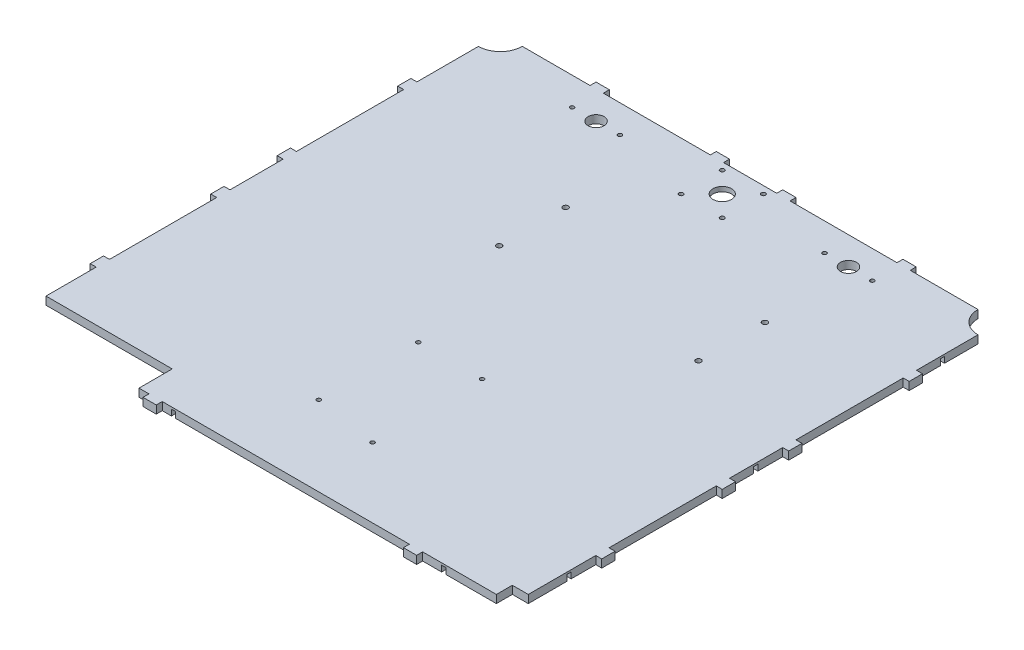
from build123d import *

# Parameters (mm, degrees)
SALIENTE_EXTRUIR1_DEPTH = 6
CORTAR_EXTRUIR1_DEPTH   = 4.5
CROQUIS5_R              = 7
CROQUIS5_R_2            = 1.6
CROQUIS5_R_3            = 6
CROQUIS5_R_4            = 1.5
CROQUIS5_W              = 12
CROQUIS5_H              = 12
CORTAR_EXTRUIR2_DEPTH   = 6
CROQUIS7_R              = 2
CROQUIS7_R_2            = 1.5
CROQUIS7_W              = 95
CROQUIS7_H              = 25
CORTAR_EXTRUIR4_DEPTH   = 10
CORTAR_EXTRUIR5_START   = -2.5
CROQUIS8_R              = 11
CROQUIS8_R_2            = 7
CROQUIS8_R_3            = 4.5
CROQUIS8_R_4            = 1.5
CORTAR_EXTRUIR5_DEPTH   = 2.5


with BuildPart() as part:
    # Croquis1 → Saliente-Extruir1 (new body)
    with BuildSketch(Plane(origin=(0, 0, 0), x_dir=(1, 0, 0), z_dir=(0, 1, 0))):
        with BuildLine():
            Line((0, 0), (67.5, 0))
            Line((67.5, 0), (77.5, 0))
            Line((77.5, 0), (102.5, 0))
            Line((102.5, 0), (102.5, -4.5))
            Line((102.5, -4.5), (112.5, -4.5))
            Line((112.5, -4.5), (112.5, 0))
            Line((112.5, 0), (298.5, 0))
            Line((298.5, 0), (298.5, -4.5))
            Line((298.5, -4.5), (308.5, -4.5))
            Line((308.5, -4.5), (308.5, 0))
            Line((308.5, 0), (376, 0))
            Line((376, 0), (376, 62.8))
            Line((376, 62.8), (380.5, 62.8))
            Line((380.5, 62.8), (380.5, 72.8))
            Line((380.5, 72.8), (376, 72.8))
            Line((376, 72.8), (376, 153.5))
            Line((376, 153.5), (380.5, 153.5))
            Line((380.5, 153.5), (380.5, 163.5))
            Line((380.5, 163.5), (376, 163.5))
            Line((376, 163.5), (376, 203.5))
            Line((376, 203.5), (380.5, 203.5))
            Line((380.5, 203.5), (380.5, 213.5))
            Line((380.5, 213.5), (376, 213.5))
            Line((376, 213.5), (376, 294.2))
            Line((376, 294.2), (380.5, 294.2))
            Line((380.5, 294.2), (380.5, 304.2))
            Line((380.5, 304.2), (376, 304.2))
            Line((376, 304.2), (376, 350.5))
            ThreePointArc((376, 350.5), (364.33273811, 355.33273811), (359.5, 367))
            Line((359.5, 367), (308.5, 367))
            Line((308.5, 367), (308.5, 371.5))
            Line((308.5, 371.5), (298.5, 371.5))
            Line((298.5, 371.5), (298.5, 367))
            Line((298.5, 367), (218, 367))
            Line((218, 367), (218, 371.5))
            Line((218, 371.5), (208, 371.5))
            Line((208, 371.5), (208, 367))
            Line((208, 367), (168, 367))
            Line((168, 367), (168, 371.5))
            Line((168, 371.5), (158, 371.5))
            Line((158, 371.5), (158, 367))
            Line((158, 367), (77.5, 367))
            Line((77.5, 367), (77.5, 371.5))
            Line((77.5, 371.5), (67.5, 371.5))
            Line((67.5, 371.5), (67.5, 367))
            Line((67.5, 367), (16.5, 367))
            ThreePointArc((16.5, 367), (11.66726189, 355.33273811), (0, 350.5))
            Line((0, 350.5), (0, 304.2))
            Line((0, 304.2), (-4.5, 304.2))
            Line((-4.5, 304.2), (-4.5, 294.2))
            Line((-4.5, 294.2), (0, 294.2))
            Line((0, 294.2), (0, 213.5))
            Line((0, 213.5), (-4.5, 213.5))
            Line((-4.5, 213.5), (-4.5, 203.5))
            Line((-4.5, 203.5), (0, 203.5))
            Line((0, 203.5), (0, 163.5))
            Line((0, 163.5), (-4.5, 163.5))
            Line((-4.5, 163.5), (-4.5, 153.5))
            Line((-4.5, 153.5), (0, 153.5))
            Line((0, 153.5), (0, 72.8))
            Line((0, 72.8), (-4.5, 72.8))
            Line((-4.5, 72.8), (-4.5, 62.8))
            Line((-4.5, 62.8), (0, 62.8))
            Line((0, 62.8), (0, 0))
        make_face()
    extrude(amount=-SALIENTE_EXTRUIR1_DEPTH)

    # Croquis3 → Cortar-Extruir1 (cut)
    with BuildSketch(Plane.XZ.offset(6)):
        with BuildLine():
            Line((325.901879925, -6.500225242), (325.901879925, 0))
            Line((325.901879925, 0), (322.801879925, 0))
            Line((322.801879925, 0), (322.801879925, -6.500225243))
            ThreePointArc((322.801879925, -6.500225243), (321.87727529, -7.028314779), (321.511542294, -8.028320611))
            Line((321.511542294, -8.028320611), (321.511542294, -9.578320611))
            ThreePointArc((321.511542294, -9.578320611), (321.700239124, -10.319504582), (322.220385751, -10.880225243))
            Line((322.220385751, -10.880225243), (322.389630684, -10.880225243))
            ThreePointArc((322.389630684, -10.880225243), (324.351879925, -11.693235227), (326.314129166, -10.880225242))
            Line((326.314129166, -10.880225242), (326.483374099, -10.880225243))
            ThreePointArc((326.483374099, -10.880225243), (327.003520726, -10.319504582), (327.192217556, -9.578320611))
            Line((327.192217556, -9.578320611), (327.192217556, -8.028320611))
            ThreePointArc((327.192217556, -8.028320611), (326.82648456, -7.028314779), (325.901879925, -6.500225242))
        make_face()
        with BuildLine():
            Line((322.801879925, -360.499774758), (322.801879925, -367))
            Line((322.801879925, -367), (325.901879925, -367))
            Line((325.901879925, -367), (325.901879925, -360.499774758))
            ThreePointArc((325.901879925, -360.499774758), (326.82648456, -359.971685221), (327.192217556, -358.971679389))
            Line((327.192217556, -358.971679389), (327.192217556, -357.421679389))
            ThreePointArc((327.192217556, -357.421679389), (327.003520726, -356.680495418), (326.483374099, -356.119774758))
            Line((326.483374099, -356.119774758), (326.314129166, -356.119774758))
            ThreePointArc((326.314129166, -356.119774758), (324.351879925, -355.306764773), (322.389630684, -356.119774757))
            Line((322.389630684, -356.119774757), (322.220385751, -356.119774757))
            ThreePointArc((322.220385751, -356.119774757), (321.700239124, -356.680495418), (321.511542294, -357.421679389))
            Line((321.511542294, -357.421679389), (321.511542294, -358.971679389))
            ThreePointArc((321.511542294, -358.971679389), (321.87727529, -359.971685221), (322.801879925, -360.499774758))
        make_face()
        with BuildLine():
            Line((6.500225243, -322.280922321), (0, -322.280922321))
            Line((0, -322.280922321), (0, -325.537612435))
            Line((0, -325.537612435), (6.500225243, -325.537612435))
            ThreePointArc((6.500225243, -325.537612435), (7.028314779, -326.46221707), (8.028320611, -326.827950066))
            Line((8.028320611, -326.827950066), (9.578320611, -326.827950066))
            ThreePointArc((9.578320611, -326.827950066), (10.319504582, -326.639253236), (10.880225243, -326.119106609))
            Line((10.880225243, -326.119106609), (10.880225243, -326.106551791))
            ThreePointArc((10.880225243, -326.106551791), (11.806178748, -323.987612435), (10.880225243, -321.86867308))
            Line((10.880225243, -321.86867308), (10.880225243, -321.699428147))
            ThreePointArc((10.880225243, -321.699428147), (10.606581913, -321.380766302), (10.257428876, -321.147274975))
            Line((10.257428876, -321.147274975), (8.707428876, -321.147274975))
            ThreePointArc((8.707428876, -321.147274975), (7.320165365, -321.161811269), (6.500225243, -322.280922321))
        make_face()
        with BuildLine():
            Line((6.500225242, -41.36), (0, -41.36))
            Line((0, -41.36), (0, -44.46))
            Line((0, -44.46), (6.500225243, -44.46))
            ThreePointArc((6.500225243, -44.46), (7.028314779, -45.384604635), (8.028320611, -45.750337631))
            Line((8.028320611, -45.750337631), (9.578320611, -45.750337631))
            ThreePointArc((9.578320611, -45.750337631), (10.319504582, -45.561640801), (10.880225243, -45.041494174))
            Line((10.880225243, -45.041494174), (10.880225243, -44.872249241))
            ThreePointArc((10.880225243, -44.872249241), (11.693235227, -42.91), (10.880225243, -40.947750759))
            Line((10.880225243, -40.947750759), (10.880225243, -40.778505826))
            ThreePointArc((10.880225243, -40.778505826), (10.319504582, -40.258359199), (9.578320611, -40.069662369))
            Line((9.578320611, -40.069662369), (8.028320611, -40.069662369))
            ThreePointArc((8.028320611, -40.069662369), (7.028314779, -40.435395365), (6.500225242, -41.36))
        make_face()
        with BuildLine():
            Line((8.028320611, -186.245954203), (9.578320611, -186.245954203))
            ThreePointArc((9.578320611, -186.245954203), (10.319504582, -186.057257373), (10.880225243, -185.537110746))
            Line((10.880225243, -185.537110746), (10.880225243, -185.367865814))
            ThreePointArc((10.880225243, -185.367865814), (11.693235227, -183.405616572), (10.880225243, -181.443367331))
            Line((10.880225243, -181.443367331), (10.880225243, -181.274122399))
            ThreePointArc((10.880225243, -181.274122399), (10.319504582, -180.753975771), (9.578320611, -180.565278941))
            Line((9.578320611, -180.565278941), (8.028320611, -180.565278941))
            ThreePointArc((8.028320611, -180.565278941), (7.028314779, -180.931011938), (6.500225243, -181.855616572))
            Line((6.500225243, -181.855616572), (0, -181.855616572))
            Line((0, -181.855616572), (0, -184.955616572))
            Line((0, -184.955616572), (6.500225243, -184.955616572))
            ThreePointArc((6.500225243, -184.955616572), (7.028314779, -185.880221207), (8.028320611, -186.245954203))
        make_face()
        with BuildLine():
            Line((122.550656557, -6.500225243), (122.550656557, 0))
            Line((122.550656557, 0), (119.450656557, 0))
            Line((119.450656557, 0), (119.450656557, -6.500225243))
            ThreePointArc((119.450656557, -6.500225243), (118.526051922, -7.028314779), (118.160318926, -8.028320611))
            Line((118.160318926, -8.028320611), (118.160318926, -9.578320611))
            ThreePointArc((118.160318926, -9.578320611), (118.349015756, -10.319504582), (118.869162383, -10.880225243))
            Line((118.869162383, -10.880225243), (119.038407316, -10.880225243))
            ThreePointArc((119.038407316, -10.880225243), (121.000656557, -11.693235227), (122.962905798, -10.880225243))
            Line((122.962905798, -10.880225243), (123.132150731, -10.880225243))
            ThreePointArc((123.132150731, -10.880225243), (123.652297358, -10.319504582), (123.840994188, -9.578320611))
            Line((123.840994188, -9.578320611), (123.840994188, -8.028320611))
            ThreePointArc((123.840994188, -8.028320611), (123.475261191, -7.028314779), (122.550656557, -6.500225243))
        make_face()
        with BuildLine():
            Line((369.499774757, -44.286426511), (376, -44.286426511))
            Line((376, -44.286426511), (376, -41.186426511))
            Line((376, -41.186426511), (369.499774757, -41.186426511))
            ThreePointArc((369.499774757, -41.186426511), (368.971685221, -40.261821877), (367.971679389, -39.89608888))
            Line((367.971679389, -39.89608888), (366.421679389, -39.89608888))
            ThreePointArc((366.421679389, -39.89608888), (365.680495418, -40.08478571), (365.119774757, -40.604932337))
            Line((365.119774757, -40.604932337), (365.119774757, -40.77417727))
            ThreePointArc((365.119774757, -40.77417727), (364.306764773, -42.736426511), (365.119774757, -44.698675752))
            Line((365.119774757, -44.698675752), (365.119774757, -44.867920685))
            ThreePointArc((365.119774757, -44.867920685), (365.680495418, -45.388067312), (366.421679389, -45.576764142))
            Line((366.421679389, -45.576764142), (367.971679389, -45.576764142))
            ThreePointArc((367.971679389, -45.576764142), (368.971685221, -45.211031146), (369.499774757, -44.286426511))
        make_face()
        with BuildLine():
            Line((367.971679389, -180.400754709), (366.421679389, -180.400754709))
            ThreePointArc((366.421679389, -180.400754709), (365.680495418, -180.589451539), (365.119774757, -181.109598166))
            Line((365.119774757, -181.109598166), (365.119774757, -181.278843099))
            ThreePointArc((365.119774757, -181.278843099), (364.306764773, -183.24109234), (365.119774757, -185.203341581))
            Line((365.119774757, -185.203341581), (365.119774757, -185.372586514))
            ThreePointArc((365.119774757, -185.372586514), (365.680495418, -185.892733141), (366.421679389, -186.081429971))
            Line((366.421679389, -186.081429971), (367.971679389, -186.081429971))
            ThreePointArc((367.971679389, -186.081429971), (368.971685221, -185.715696975), (369.499774757, -184.79109234))
            Line((369.499774757, -184.79109234), (376, -184.79109234))
            Line((376, -184.79109234), (376, -181.69109234))
            Line((376, -181.69109234), (369.499774757, -181.69109234))
            ThreePointArc((369.499774757, -181.69109234), (368.971685221, -180.766487705), (367.971679389, -180.400754709))
        make_face()
        with BuildLine():
            Line((369.499774757, -325.277950066), (376, -325.277950066))
            Line((376, -325.277950066), (376, -322.177950066))
            Line((376, -322.177950066), (369.499774757, -322.177950066))
            ThreePointArc((369.499774757, -322.177950066), (368.971685221, -321.253345432), (367.971679389, -320.887612435))
            Line((367.971679389, -320.887612435), (366.421679389, -320.887612435))
            ThreePointArc((366.421679389, -320.887612435), (365.680495418, -321.076309265), (365.119774757, -321.596455893))
            Line((365.119774757, -321.596455893), (365.119774757, -321.765700825))
            ThreePointArc((365.119774757, -321.765700825), (364.306764773, -323.727950066), (365.119774757, -325.690199308))
            Line((365.119774757, -325.690199308), (365.119774757, -325.85944424))
            ThreePointArc((365.119774757, -325.85944424), (365.680495418, -326.379590867), (366.421679389, -326.568287697))
            Line((366.421679389, -326.568287697), (367.971679389, -326.568287697))
            ThreePointArc((367.971679389, -326.568287697), (368.971685221, -326.202554701), (369.499774757, -325.277950066))
        make_face()
        with BuildLine():
            Line((50.098120075, -360.499774758), (50.098120075, -367))
            Line((50.098120075, -367), (53.198120075, -367))
            Line((53.198120075, -367), (53.198120075, -360.499774758))
            ThreePointArc((53.198120075, -360.499774758), (54.12272471, -359.971685221), (54.488457706, -358.971679389))
            Line((54.488457706, -358.971679389), (54.488457706, -357.421679389))
            ThreePointArc((54.488457706, -357.421679389), (54.299760876, -356.680495418), (53.779614249, -356.119774758))
            Line((53.779614249, -356.119774758), (53.610369316, -356.119774758))
            ThreePointArc((53.610369316, -356.119774758), (51.648120075, -355.306764773), (49.685870834, -356.119774757))
            Line((49.685870834, -356.119774757), (49.516625901, -356.119774757))
            ThreePointArc((49.516625901, -356.119774757), (48.996479274, -356.680495418), (48.807782444, -357.421679389))
            Line((48.807782444, -357.421679389), (48.807782444, -358.971679389))
            ThreePointArc((48.807782444, -358.971679389), (49.17351544, -359.971685221), (50.098120075, -360.499774758))
        make_face()
    extrude(amount=-CORTAR_EXTRUIR1_DEPTH, mode=Mode.SUBTRACT)

    # Croquis5 → Cortar-Extruir2 (cut)
    with BuildSketch(Plane(origin=(0, 0, 0), x_dir=(1, 0, 0), z_dir=(0, 1, 0))):
        with Locations(Location((188, 346, 0), (0, 0, 270))):
            Circle(CROQUIS5_R)
        with Locations(Location((172.5, 361.5, 0), (0, 0, 270))):
            Circle(CROQUIS5_R_2)
        with Locations(Location((203.5, 361.5, 0), (0, 0, 270))):
            Circle(CROQUIS5_R_2)
        with Locations(Location((203.5, 330.5, 0), (0, 0, 270))):
            Circle(CROQUIS5_R_2)
        with Locations(Location((172.5, 330.5, 0), (0, 0, 270))):
            Circle(CROQUIS5_R_2)
        with Locations(Location((93, 346, 0), (0, 0, 270))):
            Circle(CROQUIS5_R_3)
        with Locations(Location((111, 346, 0), (0, 0, 270))):
            Circle(CROQUIS5_R_4)
        with Locations(Location((75, 346, 0), (0, 0, 270))):
            Circle(CROQUIS5_R_4)
        with Locations(Location((301, 346, 0), (0, 0, 270))):
            Circle(CROQUIS5_R_4)
        with Locations(Location((265, 346, 0), (0, 0, 270))):
            Circle(CROQUIS5_R_4)
        with Locations(Location((283, 346, 0), (0, 0, 270))):
            Circle(CROQUIS5_R_3)
        with Locations((6, 6)):
            Rectangle(CROQUIS5_W, CROQUIS5_H)
        with Locations((370, 6)):
            Rectangle(CROQUIS5_W, CROQUIS5_H)
    extrude(amount=-CORTAR_EXTRUIR2_DEPTH, mode=Mode.SUBTRACT)

    # Croquis7 → Cortar-Extruir4 (cut)
    with BuildSketch(Plane(origin=(0, 0, 0), x_dir=(1, 0, 0), z_dir=(0, 1, 0))):
        with Locations(Location((137.744149305, 278.350339736, 0), (0, 0, 270))):
            Circle(CROQUIS7_R)
        with Locations(Location((137.744149305, 228.350339736, 0), (0, 0, 270))):
            Circle(CROQUIS7_R)
        with Locations(Location((287.744149305, 228.350339736, 0), (0, 0, 270))):
            Circle(CROQUIS7_R)
        with Locations(Location((287.744149305, 278.350339736, 0), (0, 0, 270))):
            Circle(CROQUIS7_R)
        with Locations(Location((218.27359351, 134.989356687, 0), (0, 0, 270))):
            Circle(CROQUIS7_R_2)
        with Locations(Location((170.27359351, 134.989356687, 0), (0, 0, 270))):
            Circle(CROQUIS7_R_2)
        with Locations(Location((218.27359351, 52.489356687, 0), (0, 0, 270))):
            Circle(CROQUIS7_R_2)
        with Locations(Location((170.27359351, 59.989356687, 0), (0, 0, 270))):
            Circle(CROQUIS7_R_2)
        with Locations((47.5, 12.5)):
            Rectangle(CROQUIS7_W, CROQUIS7_H)
    extrude(amount=-CORTAR_EXTRUIR4_DEPTH, mode=Mode.SUBTRACT)

    # Croquis8 → Cortar-Extruir5 (cut)
    # profile 1 of 5: a face of its own
    with BuildSketch(Plane.XZ.offset(6).offset(CORTAR_EXTRUIR5_START)):
        with Locations(Location((188, -346, 0), (0, 0, 270))):
            Circle(CROQUIS8_R)
        with Locations(Location((188, -346, 0), (0, 0, 90))):
            Circle(CROQUIS8_R_2, mode=Mode.SUBTRACT)
    # profile 2 of 5: a face of its own
    with BuildSketch(Plane.XZ.offset(6).offset(CORTAR_EXTRUIR5_START)):
        with Locations(Location((111, -346, 0), (0, 0, 270))):
            Circle(CROQUIS8_R_3)
    # profile 3 of 5: a face of its own
    with BuildSketch(Plane.XZ.offset(6).offset(CORTAR_EXTRUIR5_START)):
        with Locations(Location((75, -346, 0), (0, 0, 270))):
            Circle(CROQUIS8_R_3)
    # profile 4 of 5: a face of its own
    with BuildSketch(Plane.XZ.offset(6).offset(CORTAR_EXTRUIR5_START)):
        with Locations(Location((265, -346, 0), (0, 0, 270))):
            Circle(CROQUIS8_R_3)
        with Locations(Location((265, -346, 0), (0, 0, 270))):
            Circle(CROQUIS8_R_4, mode=Mode.SUBTRACT)
    # profile 5 of 5: a face of its own
    with BuildSketch(Plane.XZ.offset(6).offset(CORTAR_EXTRUIR5_START)):
        with Locations(Location((301, -346, 0), (0, 0, 270))):
            Circle(CROQUIS8_R_3)
    extrude(amount=CORTAR_EXTRUIR5_DEPTH, mode=Mode.SUBTRACT)


solid = part.part
